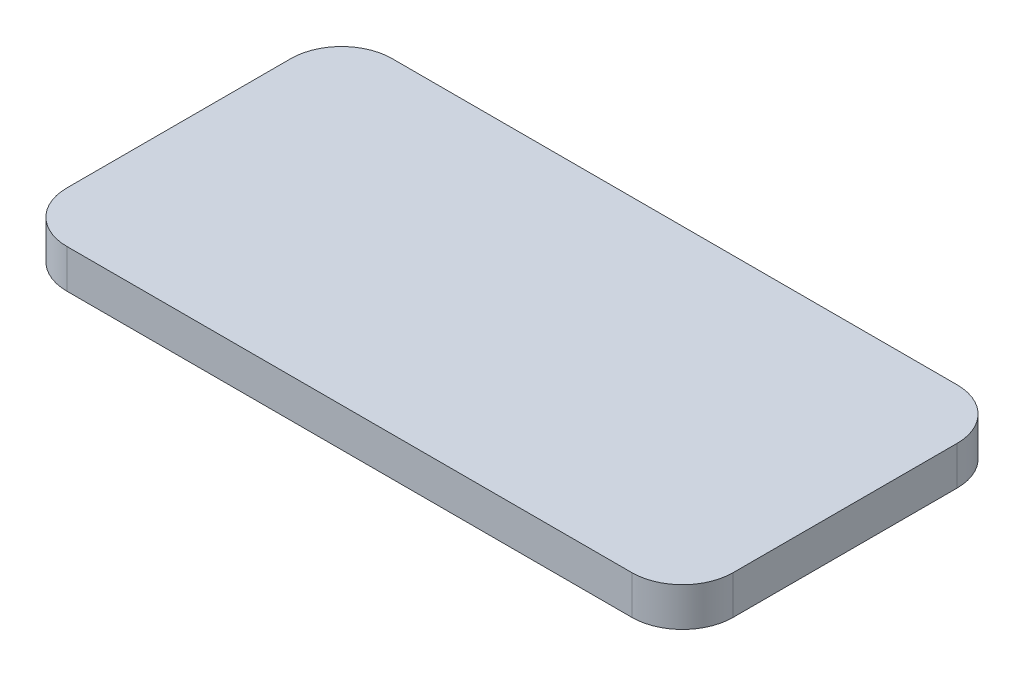
from build123d import *

# Parameters (mm, degrees)
SKETCH_1_W      = 131.5
SKETCH_1_H      = 64.2
EXTRUDE_1_DEPTH = 7.65
FILLET_1_R      = 10


with BuildPart() as part:
    # 草图1 → 凸台-拉伸1 (new body)
    with BuildSketch(Plane(origin=(0, 0, 0), x_dir=(1, 0, 0), z_dir=(0, 1, 0))):
        Rectangle(SKETCH_1_W, SKETCH_1_H)
    extrude(amount=EXTRUDE_1_DEPTH)

    # 圆角1
    fillet_1_edges = [part.edges().sort_by_distance(p)[0] for p in [
        (65.75, 3.825, 32.1),
        (-65.75, 3.825, 32.1),
        (-65.75, 3.825, -32.1),
        (65.75, 3.825, -32.1),
    ]]
    fillet(fillet_1_edges, radius=FILLET_1_R)


solid = part.part
